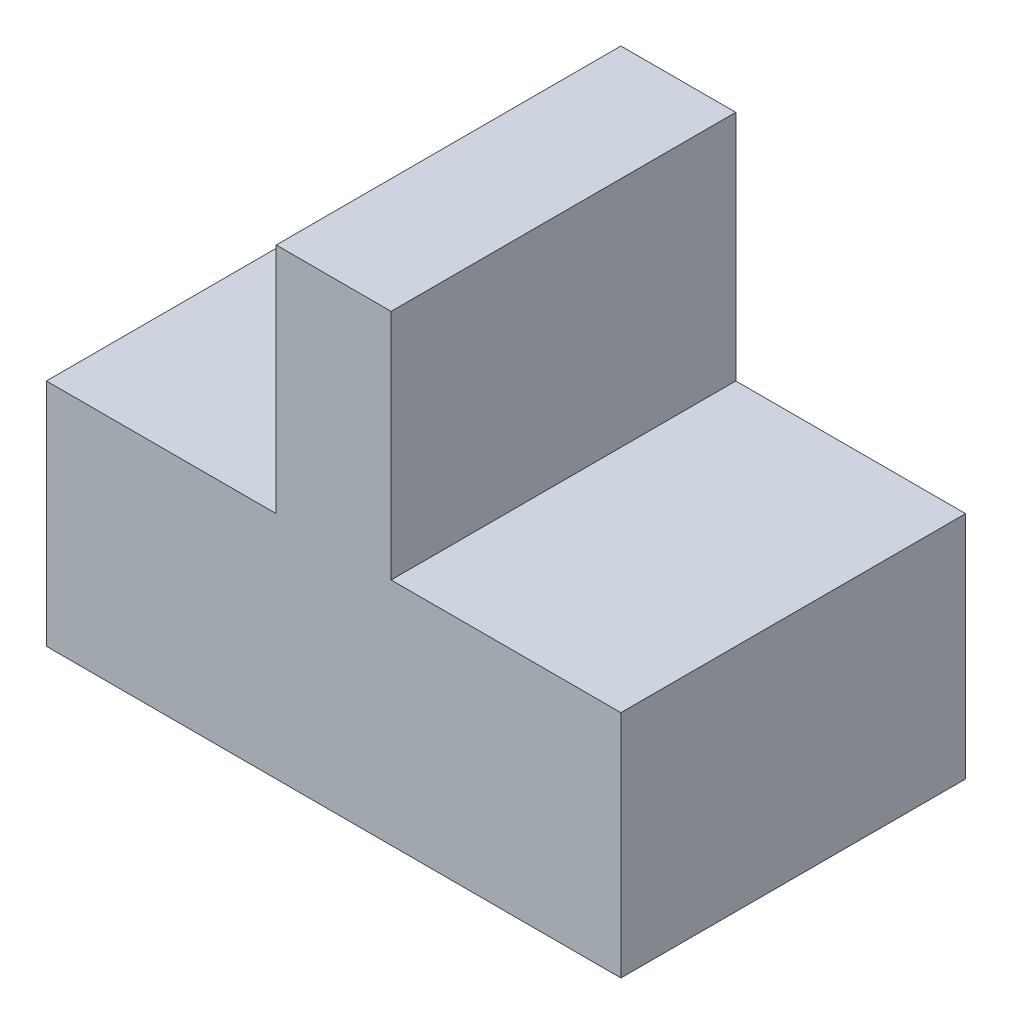
from build123d import *

# Parameters (mm, degrees)
RESSALTO_EXTRUS_O3_DEPTH = 30


with BuildPart() as part:
    # Esboço3 → Ressalto-extrusão3 (new body)
    with BuildSketch(Plane.XY):
        Polygon((0, 0), (50, 0), (50, 20), (30, 20), (30, 40.247677612), (20, 40.247677612), (20, 20), (0, 20), align=None)
    extrude(amount=RESSALTO_EXTRUS_O3_DEPTH)


solid = part.part
